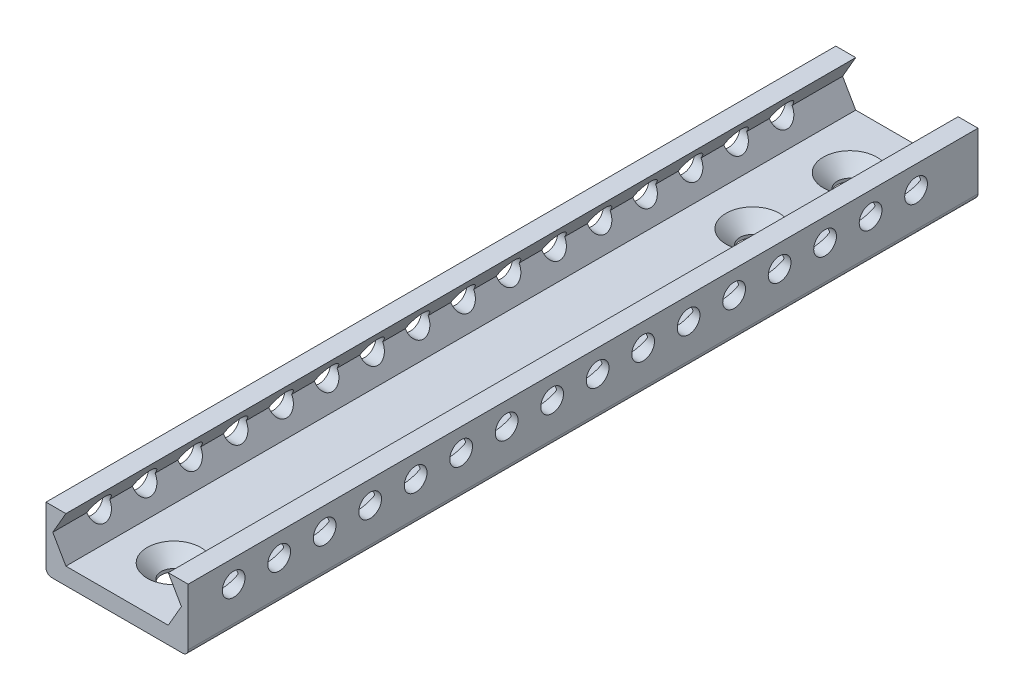
from build123d import *

# Parameters (mm, degrees)
BOSS_EXTRUDE1_DEPTH                            = 138.88615
SKETCH3_R                                      = 2
CUT_EXTRUDE2_DEPTH                             = 100
LPATTERN1_COUNT                                = 16
LPATTERN1_PITCH                                = 8
FILLET1_R                                      = 1
CSK_FOR_M4_FLAT_HEAD_MACHINE_SCREW1_AT_2_COUNT = 2
CSK_FOR_M4_FLAT_HEAD_MACHINE_SCREW1_AT_2_PITCH = 118.88615
CSK_FOR_M4_FLAT_HEAD_MACHINE_SCREW1_AT_3_COUNT = 2
CSK_FOR_M4_FLAT_HEAD_MACHINE_SCREW1_AT_3_PITCH = 101.76615


with BuildPart() as part:
    # Sketch1 → Boss-Extrude1 (new body)
    with BuildSketch(Plane.XY):
        Polygon((-9, 0), (9, 0), (11.309401077, 4), (9, 8), (12.5, 8), (12.5, -3), (-12.5, -3), (-12.5, 8), (-9, 8), (-11.309401077, 4), align=None)
    extrude(amount=-BOSS_EXTRUDE1_DEPTH)

    # Sketch3 → Cut-Extrude2 (cut)
    with BuildSketch(Plane(origin=(12.5, 0, 0), x_dir=(0, 0, -1), z_dir=(1, 0, 0))):
        with Locations((8, 4)):
            Circle(SKETCH3_R)
    cut_extrude2 = extrude(amount=-CUT_EXTRUDE2_DEPTH, mode=Mode.SUBTRACT)

    # LPattern1: Cut-Extrude2 ×16
    with Locations(*[(0, 0, -i * LPATTERN1_PITCH) for i in range(1, LPATTERN1_COUNT)]):
        add(cut_extrude2, mode=Mode.SUBTRACT)

    # Fillet1
    fillet1_edges = [part.edges().sort_by_distance(p)[0] for p in [
        (12.5, -3, -69.443075),
        (-12.5, -3, -69.443075),
    ]]
    fillet(fillet1_edges, radius=FILLET1_R)

    # Sketch5 → CSK for M4 Flat Head Machine Screw1 (revolve, cut)
    with BuildSketch(Plane(origin=(0, 0, -10), x_dir=(0, 0, 1), z_dir=(1, 0, 0))):
        Polygon((0, 0), (0, 3), (2.25, 3), (2.25, 2.45), (4.7, 0), align=None)
    csk_for_m4_flat_head_machine_screw1 = revolve(axis=Axis((0, 6.35, -10), (0, -1, 0)), mode=Mode.SUBTRACT)

    # CSK for M4 Flat Head Machine Screw1 at 2: CSK for M4 Flat Head Machine Screw1 ×2
    with Locations(*[(0, 0, -i * CSK_FOR_M4_FLAT_HEAD_MACHINE_SCREW1_AT_2_PITCH) for i in range(1, CSK_FOR_M4_FLAT_HEAD_MACHINE_SCREW1_AT_2_COUNT)]):
        add(csk_for_m4_flat_head_machine_screw1, mode=Mode.SUBTRACT)

    # CSK for M4 Flat Head Machine Screw1 at 3: CSK for M4 Flat Head Machine Screw1 ×2
    with Locations(*[(0, 0, -i * CSK_FOR_M4_FLAT_HEAD_MACHINE_SCREW1_AT_3_PITCH) for i in range(1, CSK_FOR_M4_FLAT_HEAD_MACHINE_SCREW1_AT_3_COUNT)]):
        add(csk_for_m4_flat_head_machine_screw1, mode=Mode.SUBTRACT)


solid = part.part
